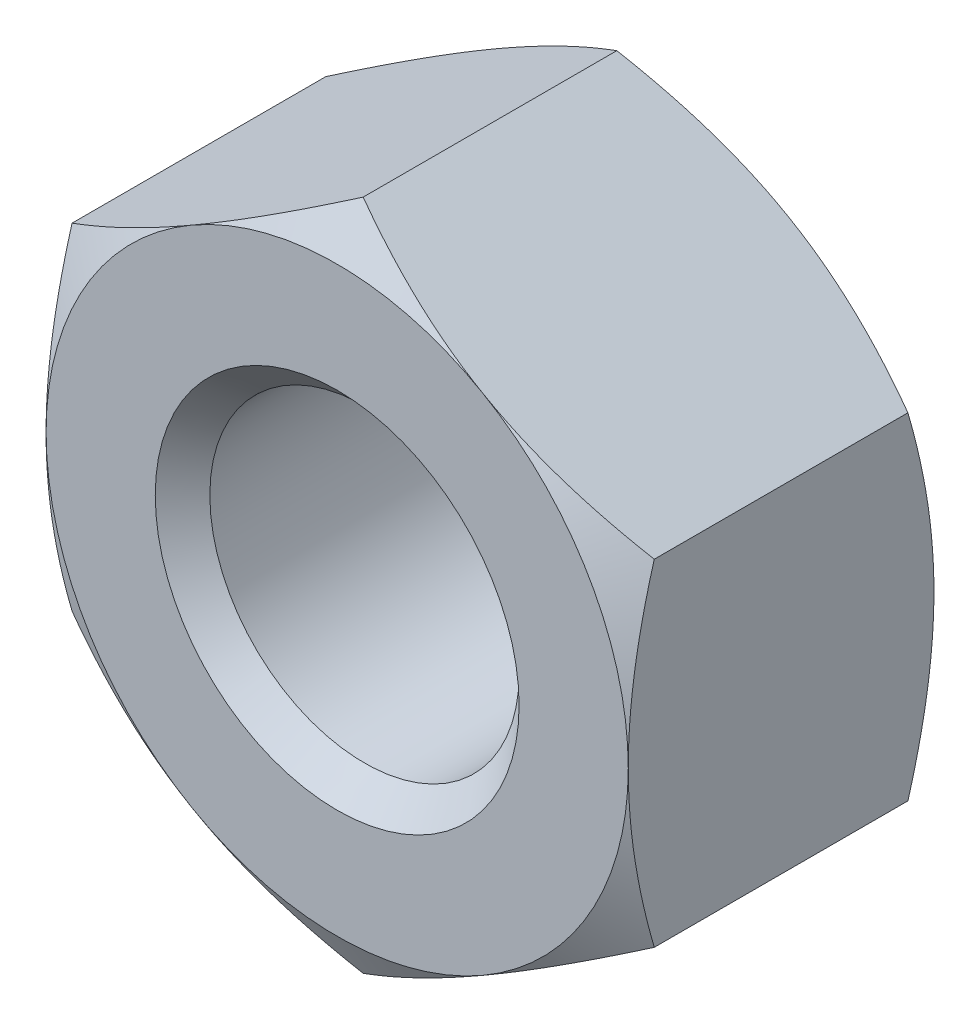
from build123d import *

# Parameters (mm, degrees)
SKETCH1_R           = 4.25
BOSS_EXTRUDE1_DEPTH = 4.2
CHAMFER1_SIZE       = 0.75


with BuildPart() as part:
    # Sketch1 → Boss-Extrude1 (new, symmetric)
    with BuildSketch(Plane.XY):
        Polygon((0, 9.237604307), (-8, 4.618802154), (-8, -4.618802154), (0, -9.237604307), (8, -4.618802154), (8, 4.618802154), align=None)
        Circle(SKETCH1_R, mode=Mode.SUBTRACT)
    extrude(amount=BOSS_EXTRUDE1_DEPTH, both=True)

    # Sketch4 → Cut-Revolve5 (revolve, cut)
    with BuildSketch(Plane(origin=(0, 0, 0), x_dir=(0, 0, -1), z_dir=(1, 0, 0))):
        Polygon((3.48546882, 9.237604307), (4.2, 8), (4.2, 9.237604307), align=None)
    revolve(axis=Axis((0, 0, 0), (0, 0, -1)), mode=Mode.SUBTRACT)

    # Sketch5 → Cut-Revolve6 (revolve, cut)
    with BuildSketch(Plane(origin=(0, 0, 0), x_dir=(0, 0, -1), z_dir=(1, 0, 0))):
        Polygon((-3.48546882, 9.237604307), (-4.2, 8), (-4.2, 9.237604307), align=None)
    revolve(axis=Axis((0, 0, 0), (0, 0, 1)), mode=Mode.SUBTRACT)

    # Chamfer1
    chamfer1_edges = [part.edges().sort_by_distance(p)[0] for p in [
        (-4.25, 0, -4.2),
        (-4.25, 0, 4.2),
    ]]
    chamfer(chamfer1_edges, length=CHAMFER1_SIZE)


solid = part.part
